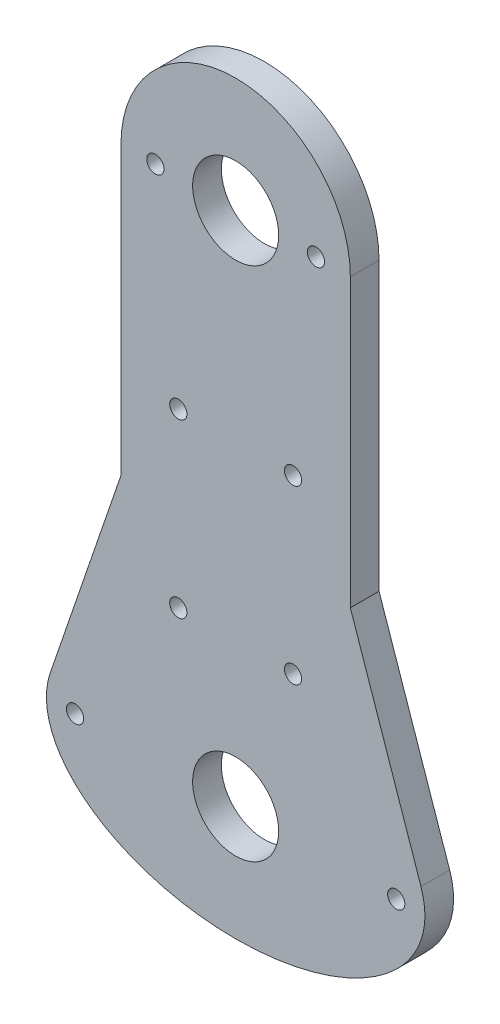
from build123d import *

# Parameters (mm, degrees)
EXTRUDE_1_DEPTH          = 5
CUT_EXTRUDE_2_DEPTH      = 115.952164093
CUT_EXTRUDE_2_DEPTH_BACK = 115.952164093
SKETCH_3_OUTSIDE_W       = 97.176
SKETCH_3_OUTSIDE_H       = 161.176
SKETCH_3_OUTSIDE_R       = 7.5
SKETCH_4_R               = 7.5
CUT_EXTRUDE_3_DEPTH      = 115.952164093
SKETCH_5_R               = 1.5
CUT_EXTRUDE_4_DEPTH      = 5


with BuildPart() as part:
    # 草图1 → 凸台-拉伸1 (new body)
    with BuildSketch(Plane.XY):
        with BuildLine():
            Line((-20, 0), (-20, -50))
            Line((-20, -50), (-20, -74.091630608))
            add(Edge.make_bspline(
                [(-2.03e-07, -70), (-11.13946442, -70.000000042), (-20, -74.091630608)],
                knots=[4.712388987, 4.712388987, 4.712388987, 5.363487565, 5.363487565, 5.363487565], degree=2, weights=[1, 0.947475191, 1]))
            add(Edge.make_bspline(
                [(20, -74.091630608), (11.13946424, -69.999999958), (-2.03e-07, -70)],
                knots=[4.061290395, 4.061290395, 4.061290395, 4.712388987, 4.712388987, 4.712388987], degree=2, weights=[1, 0.947475189, 1]))
            Line((20, -74.091630608), (20, -50))
            Line((20, -50), (20, 0))
            ThreePointArc((20, 0), (0, -20), (-20, 0))
        make_face()
        with BuildLine():
            Line((-20, -74.091630608), (-20, -50))
            Line((-20, -50), (-32.310858712, -85.934042004))
            add(Edge.make_bspline(
                [(-20, -74.091630608), (-29.804870228, -78.619337355), (-32.310858712, -85.934042004)],
                knots=[5.363487565, 5.363487565, 5.363487565, 6.078460318, 6.078460318, 6.078460318], degree=2, weights=[1, 0.936779351, 1]))
        make_face()
        with BuildLine():
            add(Edge.make_bspline(
                [(-20, -74.091630608), (-29.804870228, -78.619337355), (-32.310858712, -85.934042004)],
                knots=[5.363487565, 5.363487565, 5.363487565, 6.078460318, 6.078460318, 6.078460318], degree=2, weights=[1, 0.936779351, 1]))
            add(Edge.make_bspline(
                [(-32.310858712, -85.934042004), (-33, -87.945569596), (-33, -90)],
                knots=[6.078460318, 6.078460318, 6.078460318, 6.283185307, 6.283185307, 6.283185307], degree=2, weights=[1, 0.994765533, 1]))
            add(Edge.make_bspline(
                [(-33, -90), (-33, -109.999999875), (-2.06e-07, -110)],
                knots=[0, 0, 0, 1.570796321, 1.570796321, 1.570796321], degree=2, weights=[1, 0.707106783, 1]))
            ThreePointArc((-2.06e-07, -110), (-14.142135697, -104.142135551), (-20, -90))
            Line((-20, -90), (-20, -74.091630608))
        make_face()
        with BuildLine():
            add(Edge.make_bspline(
                [(-2.03e-07, -70), (-11.13946442, -70.000000042), (-20, -74.091630608)],
                knots=[4.712388987, 4.712388987, 4.712388987, 5.363487565, 5.363487565, 5.363487565], degree=2, weights=[1, 0.947475191, 1]))
            Line((-20, -74.091630608), (-20, -90))
            ThreePointArc((-20, -90), (-14.142135696, -75.857864448), (-2.03e-07, -70))
        make_face()
        with BuildLine():
            add(Edge.make_bspline(
                [(-20, -74.091630608), (-29.804870228, -78.619337355), (-32.310858712, -85.934042004)],
                knots=[5.363487565, 5.363487565, 5.363487565, 6.078460318, 6.078460318, 6.078460318], degree=2, weights=[1, 0.936779351, 1]))
            add(Edge.make_bspline(
                [(-32.310858712, -85.934042004), (-33, -87.945569596), (-33, -90)],
                knots=[6.078460318, 6.078460318, 6.078460318, 6.283185307, 6.283185307, 6.283185307], degree=2, weights=[1, 0.994765533, 1]))
            add(Edge.make_bspline(
                [(-33, -90), (-33, -109.999999875), (-2.06e-07, -110)],
                knots=[0, 0, 0, 1.570796321, 1.570796321, 1.570796321], degree=2, weights=[1, 0.707106783, 1]))
            ThreePointArc((-2.06e-07, -110), (-14.142135697, -104.142135551), (-20, -90))
            Line((-20, -90), (-20, -74.091630608))
        make_face()
        with BuildLine():
            add(Edge.make_bspline(
                [(-2.03e-07, -70), (-11.13946442, -70.000000042), (-20, -74.091630608)],
                knots=[4.712388987, 4.712388987, 4.712388987, 5.363487565, 5.363487565, 5.363487565], degree=2, weights=[1, 0.947475191, 1]))
            Line((-20, -74.091630608), (-20, -90))
            ThreePointArc((-20, -90), (-14.142135696, -75.857864448), (-2.03e-07, -70))
        make_face()
        with BuildLine():
            add(Edge.make_bspline(
                [(20, -74.091630608), (11.13946424, -69.999999958), (-2.03e-07, -70)],
                knots=[4.061290395, 4.061290395, 4.061290395, 4.712388987, 4.712388987, 4.712388987], degree=2, weights=[1, 0.947475189, 1]))
            ThreePointArc((-2.03e-07, -70), (14.142135552, -75.857864304), (20, -90))
            Line((20, -90), (20, -74.091630608))
        make_face()
        with BuildLine():
            ThreePointArc((20, -90), (14.142135551, -104.142135697), (-2.06e-07, -110))
            add(Edge.make_bspline(
                [(-2.06e-07, -110), (40.555759481, -110.000000153), (32.310858712, -85.934042004)],
                knots=[1.570796321, 1.570796321, 1.570796321, 3.346317643, 3.346317643, 3.346317643], degree=2, weights=[1, 0.631150574, 1]))
            add(Edge.make_bspline(
                [(32.310858712, -85.934042004), (29.804870228, -78.619337355), (20, -74.091630608)],
                knots=[3.346317643, 3.346317643, 3.346317643, 4.061290395, 4.061290395, 4.061290395], degree=2, weights=[1, 0.936779351, 1]))
            Line((20, -74.091630608), (20, -90))
        make_face()
        with BuildLine():
            Line((32.310858712, -85.934042004), (20, -50))
            Line((20, -50), (20, -74.091630608))
            add(Edge.make_bspline(
                [(32.310858712, -85.934042004), (29.804870228, -78.619337355), (20, -74.091630608)],
                knots=[3.346317643, 3.346317643, 3.346317643, 4.061290395, 4.061290395, 4.061290395], degree=2, weights=[1, 0.936779351, 1]))
        make_face()
        with BuildLine():
            add(Edge.make_bspline(
                [(20, -74.091630608), (11.13946424, -69.999999958), (-2.03e-07, -70)],
                knots=[4.061290395, 4.061290395, 4.061290395, 4.712388987, 4.712388987, 4.712388987], degree=2, weights=[1, 0.947475189, 1]))
            ThreePointArc((-2.03e-07, -70), (14.142135552, -75.857864304), (20, -90))
            Line((20, -90), (20, -74.091630608))
        make_face()
        with BuildLine():
            ThreePointArc((20, -90), (14.142135551, -104.142135697), (-2.06e-07, -110))
            add(Edge.make_bspline(
                [(-2.06e-07, -110), (40.555759481, -110.000000153), (32.310858712, -85.934042004)],
                knots=[1.570796321, 1.570796321, 1.570796321, 3.346317643, 3.346317643, 3.346317643], degree=2, weights=[1, 0.631150574, 1]))
            add(Edge.make_bspline(
                [(32.310858712, -85.934042004), (29.804870228, -78.619337355), (20, -74.091630608)],
                knots=[3.346317643, 3.346317643, 3.346317643, 4.061290395, 4.061290395, 4.061290395], degree=2, weights=[1, 0.936779351, 1]))
            Line((20, -74.091630608), (20, -90))
        make_face()
        with BuildLine():
            ThreePointArc((20, 0), (0, 20), (-20, 0))
            Line((-20, 0), (20, 0))
        make_face()
        with BuildLine():
            Line((20, 0), (-20, 0))
            ThreePointArc((-20, 0), (0, -20), (20, 0))
        make_face()
        with BuildLine():
            ThreePointArc((20, 0), (0, 20), (-20, 0))
            Line((-20, 0), (20, 0))
        make_face()
        with BuildLine():
            Line((20, 0), (-20, 0))
            ThreePointArc((-20, 0), (0, -20), (20, 0))
        make_face()
        with BuildLine():
            ThreePointArc((-2.03e-07, -70), (-14.142135696, -75.857864448), (-20, -90))
            Line((-20, -90), (20, -90))
            ThreePointArc((20, -90), (14.142135552, -75.857864304), (-2.03e-07, -70))
        make_face()
        with BuildLine():
            Line((20, -90), (-20, -90))
            ThreePointArc((-20, -90), (-14.142135697, -104.142135551), (-2.06e-07, -110))
            ThreePointArc((-2.06e-07, -110), (14.142135551, -104.142135697), (20, -90))
        make_face()
        with BuildLine():
            ThreePointArc((-2.03e-07, -70), (-14.142135696, -75.857864448), (-20, -90))
            Line((-20, -90), (20, -90))
            ThreePointArc((20, -90), (14.142135552, -75.857864304), (-2.03e-07, -70))
        make_face()
        with BuildLine():
            Line((20, -90), (-20, -90))
            ThreePointArc((-20, -90), (-14.142135697, -104.142135551), (-2.06e-07, -110))
            ThreePointArc((-2.06e-07, -110), (14.142135551, -104.142135697), (20, -90))
        make_face()
    extrude(amount=EXTRUDE_1_DEPTH)

    # 草图3 outside → 切除-拉伸2 (cut, two sides: drawn at the far end of the back side and taken through both)
    # profile 1 of 2: a face of its own
    with BuildSketch(Plane.XY.offset(5).offset(-CUT_EXTRUDE_2_DEPTH_BACK)):
        with Locations((0, -45)):
            Rectangle(SKETCH_3_OUTSIDE_W, SKETCH_3_OUTSIDE_H)
        with BuildLine():
            Line((32.310858712, -85.934042004), (20, -50))
            Line((20, -50), (20, 0))
            ThreePointArc((20, 0), (0, 20), (-20, 0))
            Line((-20, 0), (-20, -50))
            Line((-20, -50), (-32.310858712, -85.934042004))
            add(Edge.make_bspline(
                [(-32.310858712, -85.934042004), (-40.555759429, -110), (0, -110), (40.555759429, -110), (32.310858712, -85.934042004)],
                knots=[6.078460318, 6.078460318, 6.078460318, 7.853981634, 7.853981634, 9.62950295, 9.62950295, 9.62950295], degree=2, weights=[1, 0.631150576, 1, 0.631150576, 1]))
        make_face(mode=Mode.SUBTRACT)
    # profile 2 of 2: a face of its own
    with BuildSketch(Plane.XY.offset(5).offset(-CUT_EXTRUDE_2_DEPTH_BACK)):
        with Locations((0, -90)):
            Circle(SKETCH_3_OUTSIDE_R)
    extrude(amount=CUT_EXTRUDE_2_DEPTH + CUT_EXTRUDE_2_DEPTH_BACK, mode=Mode.SUBTRACT)

    # 草图4 → 切除-拉伸3 (cut, through all)
    with BuildSketch(Plane.XY.offset(5)):
        Circle(SKETCH_4_R)
    extrude(amount=-CUT_EXTRUDE_3_DEPTH, mode=Mode.SUBTRACT)

    # 草图5 → 切除-拉伸4 (cut)
    with BuildSketch(Plane.XY.offset(5)):
        with Locations((28, -90)):
            Circle(SKETCH_5_R)
        with Locations((14, 0)):
            Circle(SKETCH_5_R)
        with Locations((10, -35)):
            Circle(SKETCH_5_R)
        with Locations((10, -65)):
            Circle(SKETCH_5_R)
        with Locations((-14, 0)):
            Circle(SKETCH_5_R)
        with Locations((-10, -35)):
            Circle(SKETCH_5_R)
        with Locations((-10, -65)):
            Circle(SKETCH_5_R)
        with Locations((-28, -90)):
            Circle(SKETCH_5_R)
    extrude(amount=-CUT_EXTRUDE_4_DEPTH, mode=Mode.SUBTRACT)


solid = part.part
